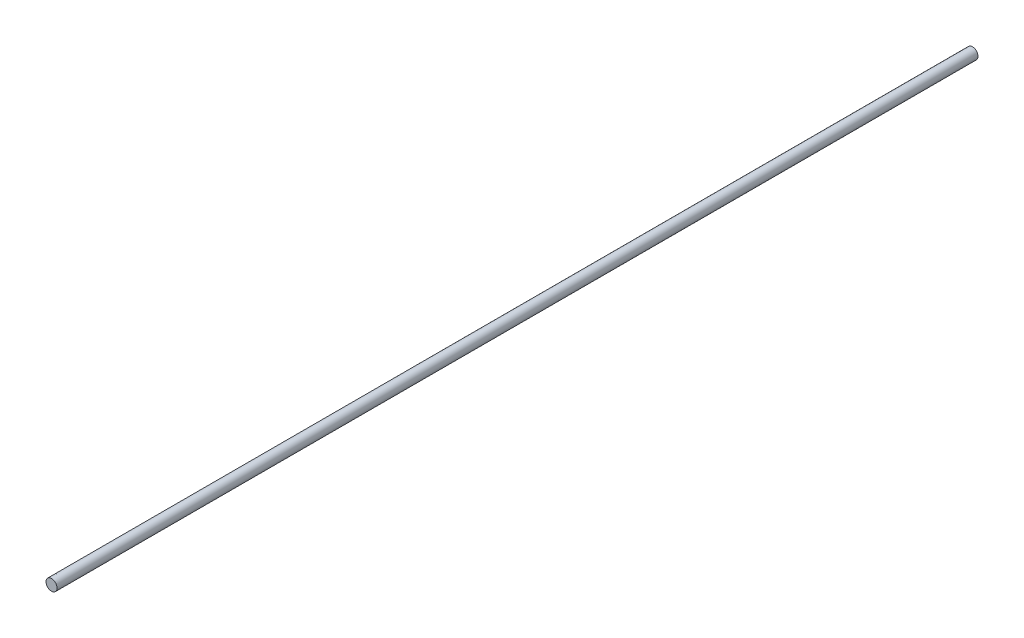
from build123d import *

# Parameters (mm, degrees)
ESQUISSE1_R        = 3
BOSS_EXTRU_1_DEPTH = 500


with BuildPart() as part:
    # Esquisse1 → Boss.-Extru.1 (new body)
    with BuildSketch(Plane.XY):
        Circle(ESQUISSE1_R)
    extrude(amount=BOSS_EXTRU_1_DEPTH)


solid = part.part
